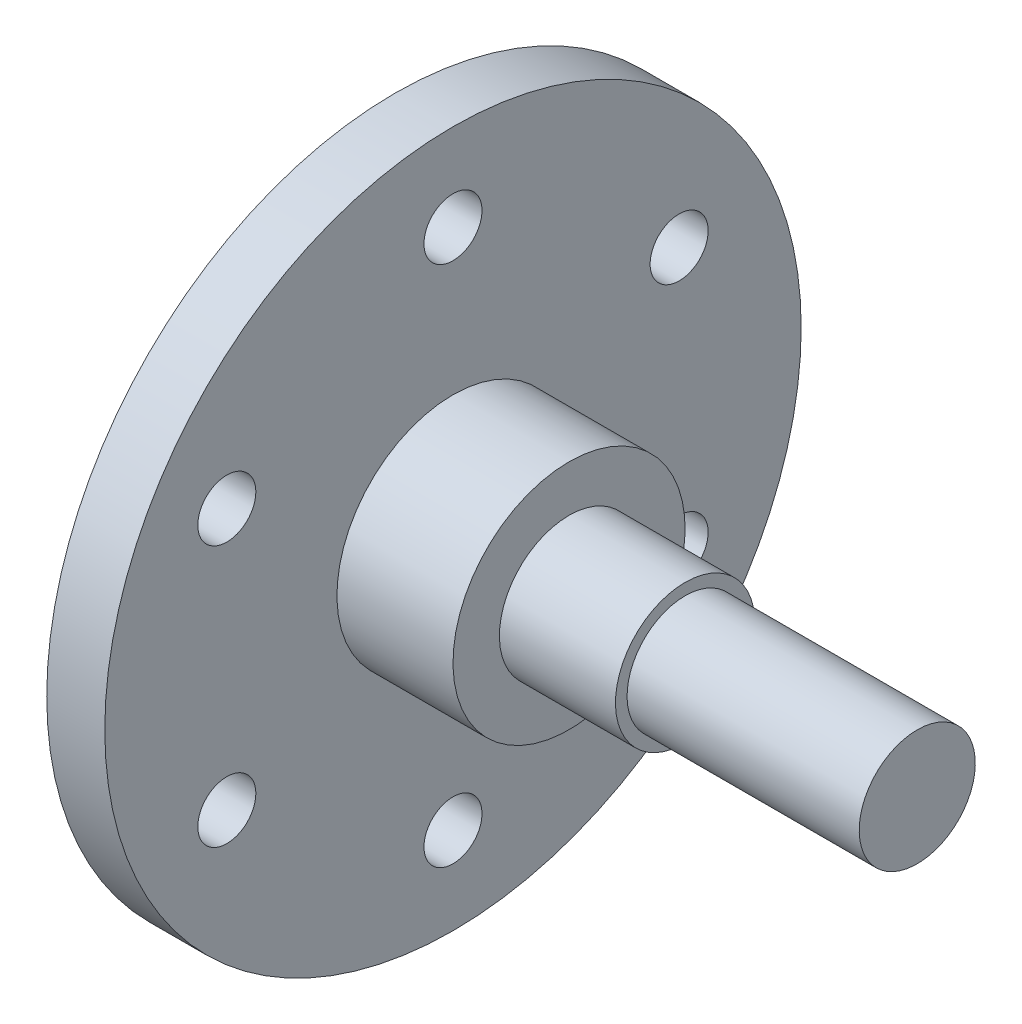
from build123d import *

# Parameters (mm, degrees)
SKETCH_2_R          = 2.5
CUT_EXTRUDE_1_DEPTH = 62.846584384


with BuildPart() as part:
    # 草图1 → 旋转2 (revolve)
    with BuildSketch(Plane.XY):
        Polygon((0, 30), (0, 0), (45, 0), (45, 5), (25, 5), (25, 6), (15, 6), (15, 10), (5, 10), (5, 30), align=None)
    revolve(axis=Axis((45, 0, 0), (-1, 0, 0)))

    # 草图2 → 切除-拉伸1 (cut, through all)
    with BuildSketch(Plane.ZY):
        with Locations(Location((0, 22.5, 0), (0, 0, 270))):
            Circle(SKETCH_2_R)
        with Locations(Location((19.485571585, 11.25, 0), (0, 0, 270))):
            Circle(SKETCH_2_R)
        with Locations(Location((19.485571585, -11.25, 0), (0, 0, 270))):
            Circle(SKETCH_2_R)
        with Locations(Location((0, -22.5, 0), (0, 0, 270))):
            Circle(SKETCH_2_R)
        with Locations(Location((-19.485571585, -11.25, 0), (0, 0, 270))):
            Circle(SKETCH_2_R)
        with Locations(Location((-19.485571585, 11.25, 0), (0, 0, 270))):
            Circle(SKETCH_2_R)
    extrude(amount=-CUT_EXTRUDE_1_DEPTH, mode=Mode.SUBTRACT)


solid = part.part
